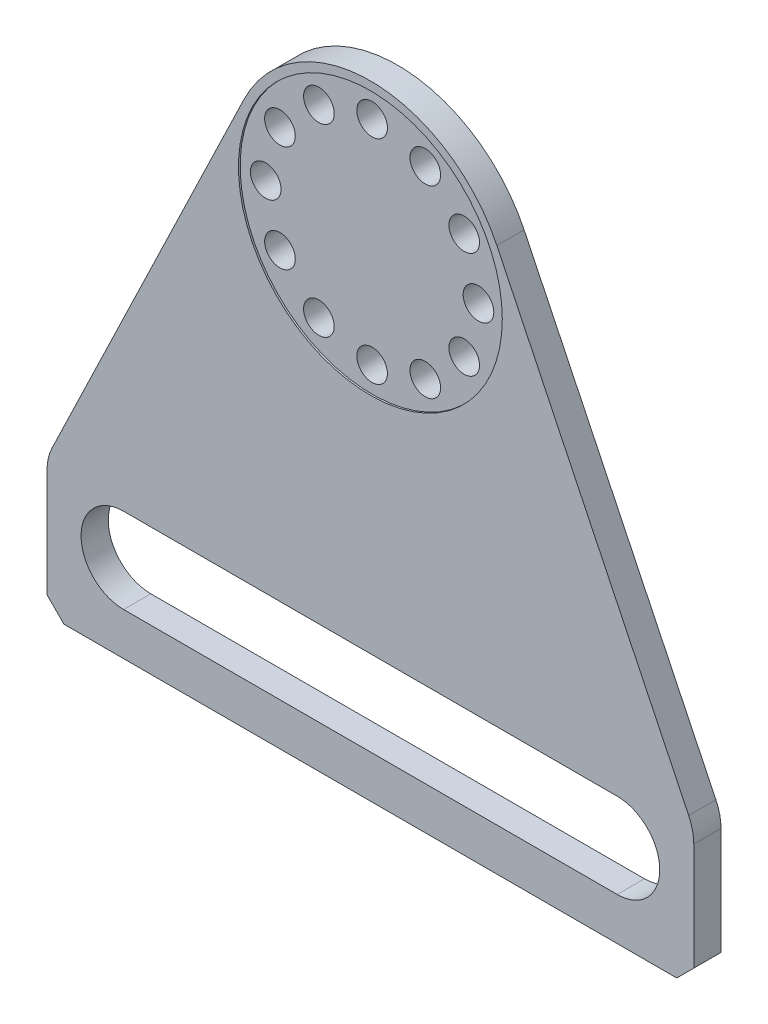
from build123d import *

# Parameters (mm, degrees)
EXTRUDE_1_DEPTH     = 16
SKETCH_2_R          = 77.5
CUT_EXTRUDE_1_DEPTH = 1
CUT_EXTRUDE_2_REACH = 344.025
SKETCH_3_R          = 9
CUT_EXTRUDE_3_REACH = 344.07
CHAMFER_1_SIZE      = 10


with BuildPart() as part:
    # 草图1 → 凸台-拉伸1 (new body)
    with BuildSketch(Plane.XY):
        with BuildLine():
            Line((-74.306819623, 35.843361414), (-187.020661681, -197.82353813))
            ThreePointArc((-187.020661681, -197.82353813), (-189.245682164, -204.172424177), (-190, -210.857487736))
            Line((-190, -210.857487736), (-190, -284))
            Line((-190, -284), (0, -284))
            Line((0, -284), (190, -284))
            Line((190, -284), (190, -210.857487736))
            ThreePointArc((190, -210.857487736), (189.245682164, -204.172424177), (187.020661681, -197.82353813))
            Line((187.020661681, -197.82353813), (74.306819623, 35.843361414))
            ThreePointArc((74.306819623, 35.843361414), (0, 82.5), (-74.306819623, 35.843361414))
        make_face()
    extrude(amount=EXTRUDE_1_DEPTH)

    # 草图2 → 切除-拉伸1 (cut)
    with BuildSketch(Plane.XY.offset(16)):
        Circle(SKETCH_2_R)
    extrude(amount=-CUT_EXTRUDE_1_DEPTH, mode=Mode.SUBTRACT)

    # 草图3 → 切除-拉伸2 (cut, up to next)
    with BuildSketch(Plane.XY.offset(15), mode=Mode.PRIVATE) as cut_extrude_2_sk1:
        with Locations((0, 62.5)):
            Circle(SKETCH_3_R)
    cut_extrude_2_tool1 = extrude(cut_extrude_2_sk1.sketch, amount=-CUT_EXTRUDE_2_REACH, mode=Mode.PRIVATE) & part.part
    # 草图3 → 切除-拉伸2 (cut, up to next)
    with BuildSketch(Plane.XY.offset(15), mode=Mode.PRIVATE) as cut_extrude_2_sk2:
        with Locations((31.25, 54.126587737)):
            Circle(SKETCH_3_R)
    cut_extrude_2_tool2 = extrude(cut_extrude_2_sk2.sketch, amount=-CUT_EXTRUDE_2_REACH, mode=Mode.PRIVATE) & part.part
    # 草图3 → 切除-拉伸2 (cut, up to next)
    with BuildSketch(Plane.XY.offset(15), mode=Mode.PRIVATE) as cut_extrude_2_sk3:
        with Locations((54.126587737, 31.25)):
            Circle(SKETCH_3_R)
    cut_extrude_2_tool3 = extrude(cut_extrude_2_sk3.sketch, amount=-CUT_EXTRUDE_2_REACH, mode=Mode.PRIVATE) & part.part
    # 草图3 → 切除-拉伸2 (cut, up to next)
    with BuildSketch(Plane.XY.offset(15), mode=Mode.PRIVATE) as cut_extrude_2_sk4:
        with Locations((62.5, 0)):
            Circle(SKETCH_3_R)
    cut_extrude_2_tool4 = extrude(cut_extrude_2_sk4.sketch, amount=-CUT_EXTRUDE_2_REACH, mode=Mode.PRIVATE) & part.part
    # 草图3 → 切除-拉伸2 (cut, up to next)
    with BuildSketch(Plane.XY.offset(15), mode=Mode.PRIVATE) as cut_extrude_2_sk5:
        with Locations((54.126587737, -31.25)):
            Circle(SKETCH_3_R)
    cut_extrude_2_tool5 = extrude(cut_extrude_2_sk5.sketch, amount=-CUT_EXTRUDE_2_REACH, mode=Mode.PRIVATE) & part.part
    # 草图3 → 切除-拉伸2 (cut, up to next)
    with BuildSketch(Plane.XY.offset(15), mode=Mode.PRIVATE) as cut_extrude_2_sk6:
        with Locations((31.25, -54.126587737)):
            Circle(SKETCH_3_R)
    cut_extrude_2_tool6 = extrude(cut_extrude_2_sk6.sketch, amount=-CUT_EXTRUDE_2_REACH, mode=Mode.PRIVATE) & part.part
    # 草图3 → 切除-拉伸2 (cut, up to next)
    with BuildSketch(Plane.XY.offset(15), mode=Mode.PRIVATE) as cut_extrude_2_sk7:
        with Locations((0, -62.5)):
            Circle(SKETCH_3_R)
    cut_extrude_2_tool7 = extrude(cut_extrude_2_sk7.sketch, amount=-CUT_EXTRUDE_2_REACH, mode=Mode.PRIVATE) & part.part
    # 草图3 → 切除-拉伸2 (cut, up to next)
    with BuildSketch(Plane.XY.offset(15), mode=Mode.PRIVATE) as cut_extrude_2_sk8:
        with Locations((-31.25, -54.126587737)):
            Circle(SKETCH_3_R)
    cut_extrude_2_tool8 = extrude(cut_extrude_2_sk8.sketch, amount=-CUT_EXTRUDE_2_REACH, mode=Mode.PRIVATE) & part.part
    # 草图3 → 切除-拉伸2 (cut, up to next)
    with BuildSketch(Plane.XY.offset(15), mode=Mode.PRIVATE) as cut_extrude_2_sk9:
        with Locations((-54.126587737, -31.25)):
            Circle(SKETCH_3_R)
    cut_extrude_2_tool9 = extrude(cut_extrude_2_sk9.sketch, amount=-CUT_EXTRUDE_2_REACH, mode=Mode.PRIVATE) & part.part
    # 草图3 → 切除-拉伸2 (cut, up to next)
    with BuildSketch(Plane.XY.offset(15), mode=Mode.PRIVATE) as cut_extrude_2_sk10:
        with Locations((-62.5, 0)):
            Circle(SKETCH_3_R)
    cut_extrude_2_tool10 = extrude(cut_extrude_2_sk10.sketch, amount=-CUT_EXTRUDE_2_REACH, mode=Mode.PRIVATE) & part.part
    # 草图3 → 切除-拉伸2 (cut, up to next)
    with BuildSketch(Plane.XY.offset(15), mode=Mode.PRIVATE) as cut_extrude_2_sk11:
        with Locations((-54.126587737, 31.25)):
            Circle(SKETCH_3_R)
    cut_extrude_2_tool11 = extrude(cut_extrude_2_sk11.sketch, amount=-CUT_EXTRUDE_2_REACH, mode=Mode.PRIVATE) & part.part
    # 草图3 → 切除-拉伸2 (cut, up to next)
    with BuildSketch(Plane.XY.offset(15), mode=Mode.PRIVATE) as cut_extrude_2_sk12:
        with Locations((-31.25, 54.126587737)):
            Circle(SKETCH_3_R)
    cut_extrude_2_tool12 = extrude(cut_extrude_2_sk12.sketch, amount=-CUT_EXTRUDE_2_REACH, mode=Mode.PRIVATE) & part.part
    add(cut_extrude_2_tool1.solids().sort_by_distance((0, 62.5, 15))[0], mode=Mode.SUBTRACT)
    add(cut_extrude_2_tool2.solids().sort_by_distance((31.25, 54.126588, 15))[0], mode=Mode.SUBTRACT)
    add(cut_extrude_2_tool3.solids().sort_by_distance((54.126588, 31.25, 15))[0], mode=Mode.SUBTRACT)
    add(cut_extrude_2_tool4.solids().sort_by_distance((62.5, 0, 15))[0], mode=Mode.SUBTRACT)
    add(cut_extrude_2_tool5.solids().sort_by_distance((54.126588, -31.25, 15))[0], mode=Mode.SUBTRACT)
    add(cut_extrude_2_tool6.solids().sort_by_distance((31.25, -54.126588, 15))[0], mode=Mode.SUBTRACT)
    add(cut_extrude_2_tool7.solids().sort_by_distance((0, -62.5, 15))[0], mode=Mode.SUBTRACT)
    add(cut_extrude_2_tool8.solids().sort_by_distance((-31.25, -54.126588, 15))[0], mode=Mode.SUBTRACT)
    add(cut_extrude_2_tool9.solids().sort_by_distance((-54.126588, -31.25, 15))[0], mode=Mode.SUBTRACT)
    add(cut_extrude_2_tool10.solids().sort_by_distance((-62.5, 0, 15))[0], mode=Mode.SUBTRACT)
    add(cut_extrude_2_tool11.solids().sort_by_distance((-54.126588, 31.25, 15))[0], mode=Mode.SUBTRACT)
    add(cut_extrude_2_tool12.solids().sort_by_distance((-31.25, 54.126588, 15))[0], mode=Mode.SUBTRACT)

    # 草图4 → 切除-拉伸3 (cut, up to next)
    with BuildSketch(Plane.XY.offset(16), mode=Mode.PRIVATE) as cut_extrude_3_sk1:
        with BuildLine():
            Line((-145, -209), (145, -209))
            ThreePointArc((145, -209), (170, -234), (145, -259))
            Line((145, -259), (-145, -259))
            ThreePointArc((-145, -259), (-170, -234), (-145, -209))
        make_face()
    cut_extrude_3_tool1 = extrude(cut_extrude_3_sk1.sketch, amount=-CUT_EXTRUDE_3_REACH, mode=Mode.PRIVATE) & part.part
    add(cut_extrude_3_tool1.solids().sort_by_distance((0, -234, 16))[0], mode=Mode.SUBTRACT)

    # 倒角1
    chamfer_1_edges = [part.edges().sort_by_distance(p)[0] for p in [
        (190, -284, 8),
        (-190, -284, 8),
    ]]
    chamfer(chamfer_1_edges, length=CHAMFER_1_SIZE)


solid = part.part
